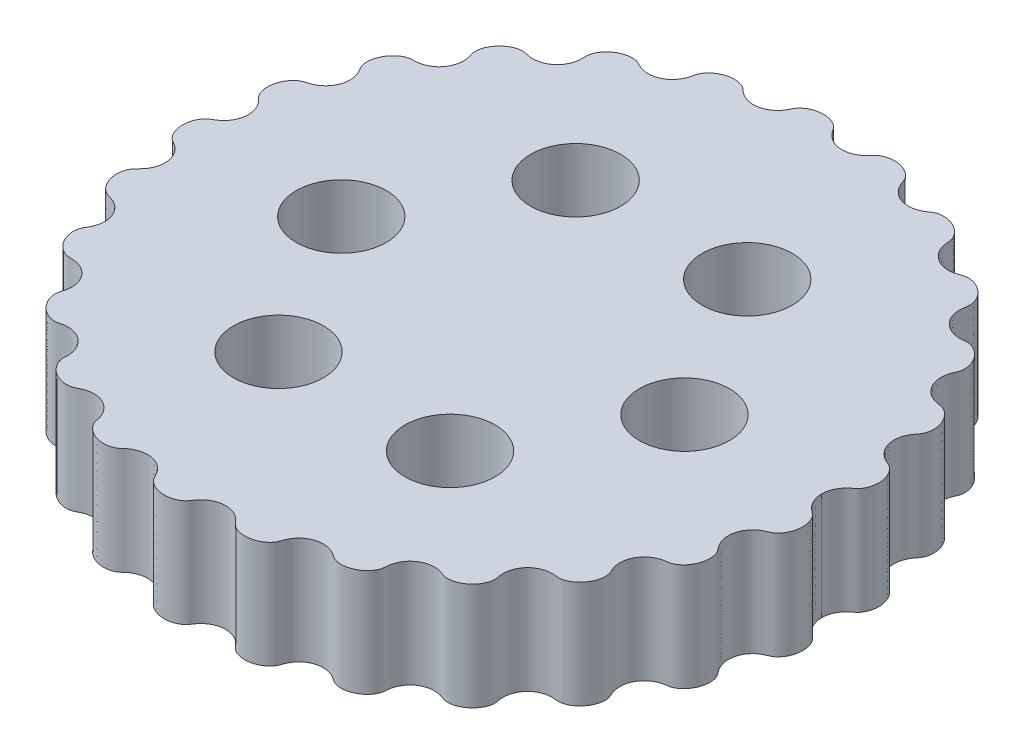
from build123d import *

# Parameters (mm, degrees)
BOSS_EXTRUDE1_DEPTH = 5
SKETCH6_R           = 2.1
CUT_EXTRUDE1_DEPTH  = 23.326267879


with BuildPart() as part:
    # Sketch4 → Boss-Extrude1 (new body)
    with BuildSketch(Plane(origin=(0, 0, 0), x_dir=(1, 0, 0), z_dir=(0, 1, 0))):
        with BuildLine():
            add(Edge.make_bspline(
                [(14.4, -1.7e-08), (14.400000001, -0.0179639), (14.400999326, -0.054155777), (14.405496287, -0.123245559), (14.417452602, -0.205733746), (14.435300791, -0.284760882), (14.458936204, -0.363829837), (14.495530725, -0.460103313), (14.553831759, -0.577672696), (14.628963289, -0.69047521), (14.720523738, -0.795156227), (14.809877944, -0.878529693), (14.885972405, -0.939710303), (14.965266318, -0.996877198), (15.039390344, -1.060755701), (15.1018131, -1.136526898), (15.154322653, -1.219306582), (15.208602449, -1.329232807), (15.256294529, -1.468797205), (15.288097075, -1.638083714), (15.294503435, -1.881017908), (15.252298066, -2.119867927), (15.1637602, -2.344380176), (15.042398564, -2.523140053), (14.94245441, -2.628650556), (14.845312037, -2.703603754), (14.757199484, -2.75037115), (14.664408662, -2.78673234), (14.573413237, -2.82696583), (14.463622, -2.885730196), (14.308968626, -2.990239544), (14.130503947, -3.16584475), (13.972147755, -3.434992937), (13.893985859, -3.773342013), (13.916927854, -4.080338903), (13.995171358, -4.310200435), (14.082412523, -4.468542002), (14.150259665, -4.567703689), (14.210026022, -4.642870296), (14.270573861, -4.71764915), (14.320176524, -4.800200553), (14.365416999, -4.910918986), (14.399338679, -5.049561592), (14.416852444, -5.262398457), (14.384340319, -5.500937501), (14.304056267, -5.731023407), (14.177986382, -5.941781709), (14.047854596, -6.095731652), (13.910789393, -6.208565653), (13.777137, -6.284416223), (13.654566629, -6.325933754), (13.550560187, -6.341335355), (13.446683903, -6.3556153), (13.344146149, -6.378219341), (13.218559064, -6.41641266), (13.049118236, -6.490187834), (12.850381491, -6.623876998), (12.649361944, -6.848376695), (12.506075667, -7.152262029), (12.46299874, -7.451003022), (12.48997225, -7.692058438), (12.539204983, -7.862350568), (12.580286972, -7.968000481), (12.61827015, -8.050352836), (12.654435799, -8.133644595), (12.678284114, -8.221362507), (12.692938305, -8.335981059), (12.690656028, -8.476153329), (12.654303526, -8.685493417), (12.545224195, -8.951239022), (12.373057401, -9.183722777), (12.149188843, -9.366304652), (11.953264529, -9.463318251), (11.811586608, -9.506241365), (11.686731924, -9.522483898), (11.583489038, -9.516968798), (11.481158628, -9.503432871), (11.378198979, -9.496859129), (11.274929533, -9.49821253), (11.172138776, -9.508022559), (11.008490275, -9.538189761), (10.791018404, -9.615836429), (10.54376529, -9.778692316), (10.34743423, -10.024278389), (10.240209593, -10.268607463), (10.194326114, -10.484243722), (10.185348079, -10.638429773), (10.193137048, -10.770510357), (10.209146619, -10.879533579), (10.225593647, -10.966240376), (10.235972878, -11.053921942), (10.233096763, -11.14231166), (10.215769233, -11.253426311), (10.176716251, -11.384209832), (10.088557736, -11.571773142), (9.914555517, -11.80057082), (9.643929478, -12.015790507), (9.33839426, -12.131431699), (9.092328835, -12.151919768), (8.938831877, -12.124722566), (8.874148355, -12.104917771), (8.823297244, -12.086266884), (8.760022234, -12.062210605), (8.657742963, -12.026792772), (8.512709046, -11.991319856), (8.295428716, -11.97104487), (8.023342576, -12.005783733), (7.739745939, -12.120021547), (7.477486579, -12.330308867), (7.309271702, -12.575786337), (7.227746068, -12.796402082), (7.194848084, -12.964652493), (7.183073794, -13.072923178), (7.177410554, -13.159952383), (7.163856527, -13.268191929), (7.120744622, -13.396146755), (7.043212114, -13.535732471), (6.896275926, -13.715388959), (6.667818283, -13.89629663), (6.347779416, -14.03871354), (6.019985541, -14.072734254), (5.761855576, -14.02689028), (5.598538488, -13.943823846), (5.51263691, -13.880075594), (5.401773626, -13.805681561), (5.259872152, -13.730304744), (5.052431839, -13.656485887), (4.77382746, -13.622953802), (4.462559435, -13.668320901), (4.188839384, -13.799904766), (3.991155398, -13.966548556), (3.857834317, -14.133926182), (3.782595695, -14.263163579), (3.730895704, -14.379947275), (3.69592382, -14.480038293), (3.66890374, -14.560561388), (3.625076907, -14.657311225), (3.549396441, -14.764707573), (3.439983046, -14.875187043), (3.255658106, -15.006023513), (2.992827177, -15.120144537), (2.651469442, -15.175704124), (2.340641018, -15.129056772), (2.125825197, -15.033765751), (2.01095266, -14.946775313), (1.969759934, -14.909017976), (1.93173959, -14.868053237), (1.895416474, -14.825543703), (1.849863622, -14.772584759), (1.773476377, -14.691024569), (1.657607797, -14.589330316), (1.467716761, -14.468702888), (1.201270806, -14.374830177), (0.894276628, -14.351781894), (0.570473221, -14.423577347), (0.317305974, -14.563244823), (0.151544702, -14.714094802), (0.048135706, -14.841769091), (-0.011407021, -14.928873544), (-0.056990631, -15.000050076), (-0.120513002, -15.08451769), (-0.216680124, -15.17111797), (-0.345491256, -15.252082884), (-0.548377405, -15.335585005), (-0.81276796, -15.385413202), (-1.083980155, -15.372591783), (-1.344979223, -15.297229029), (-1.543453081, -15.192188779), (-1.665764344, -15.097632071), (-1.75466994, -15.002005407), (-1.811224121, -14.912766255), (-1.848284502, -14.836853618), (-1.894839675, -14.742231122), (-1.981132458, -14.596441466), (-2.13046103, -14.415292593), (-2.371747135, -14.237403751), (-2.694146148, -14.1243046), (-3.005807294, -14.112083152), (-3.279802301, -14.174238455), (-3.481365526, -14.271329208), (-3.607737697, -14.358113139), (-3.692850209, -14.429558471), (-3.744273365, -14.476277951), (-3.785483991, -14.51360362), (-3.839036679, -14.557816921), (-3.971847461, -14.642561857), (-4.209211572, -14.716336999), (-4.537869609, -14.723206654), (-4.870972645, -14.623310507), (-5.119164114, -14.47411432), (-5.2872023, -14.316128509), (-5.381818777, -14.188750023), (-5.441586215, -14.068625499), (-5.469753991, -13.963937415), (-5.486204747, -13.878819236), (-5.51061517, -13.773376806), (-5.562785462, -13.611202495), (-5.668639681, -13.402851328), (-5.861501297, -13.180791236), (-6.140857489, -13.003605973), (-6.43238862, -12.920479784), (-6.707046662, -12.913936155), (-6.924586995, -12.957969238), (-7.070502232, -13.011927214), (-7.171892303, -13.061227573), (-7.234172135, -13.094294611), (-7.284237914, -13.120336964), (-7.348454125, -13.149383316), (-7.450392524, -13.181306111), (-7.592859739, -13.199325385), (-7.822504011, -13.187514265), (-8.108178823, -13.101882567), (-8.36069964, -12.948082275), (-8.564054209, -12.739258126), (-8.686860003, -12.541026141), (-8.745858699, -12.391334276), (-8.77113907, -12.257945677), (-8.769723267, -12.148159078), (-8.764488503, -12.06060027), (-8.763283534, -11.951025483), (-8.773134178, -11.82121258), (-8.801859137, -11.673190068), (-8.872937365, -11.471740845), (-9.004528254, -11.249999199), (-9.22049795, -11.035107196), (-9.499737738, -10.890462442), (-9.747533452, -10.836885462), (-9.938295916, -10.832213667), (-10.067515035, -10.843724725), (-10.169837278, -10.860858085), (-10.270401153, -10.885916097), (-10.371724701, -10.908895919), (-10.499540628, -10.914403623), (-10.649899213, -10.893032579), (-10.864421843, -10.823595982), (-11.115446738, -10.670180022), (-11.318488106, -10.46080572), (-11.461426457, -10.211875885), (-11.524752714, -10.013392151), (-11.546391671, -9.877678194), (-11.548709835, -9.764594358), (-11.539339854, -9.676135336), (-11.516898322, -9.590207442), (-11.489593068, -9.50576497), (-11.460576376, -9.39879153), (-11.437115881, -9.267755501), (-11.428038444, -9.112624579), (-11.448899273, -8.891732892), (-11.525306355, -8.644379442), (-11.680559797, -8.391694815), (-11.908334962, -8.189293006), (-12.146089512, -8.066432294), (-12.351540723, -8.011178916), (-12.509041108, -7.991840175), (-12.640826513, -7.989461218), (-12.746563832, -7.988166909), (-12.874375573, -7.9638286), (-13.017764329, -7.905880475), (-13.169248965, -7.811412503), (-13.319017823, -7.674675151), (-13.471981481, -7.480515416), (-13.581458638, -7.260884164), (-13.644013249, -7.026575852), (-13.652860905, -6.812940483), (-13.636539192, -6.672850871), (-13.606445536, -6.560514782), (-13.570431174, -6.476446714), (-13.523165972, -6.398238245), (-13.475169426, -6.320638538), (-13.421523052, -6.219949406), (-13.352206464, -6.055610198), (-13.29722316, -5.81780624), (-13.306143965, -5.511232379), (-13.418270819, -5.185793038), (-13.599550695, -4.93728619), (-13.788421679, -4.782571213), (-13.950444323, -4.693123203), (-14.068010578, -4.644082106), (-14.164678216, -4.612082102), (-14.263358735, -4.586969006), (-14.360622611, -4.556204334), (-14.472064505, -4.49721395), (-14.590574792, -4.405388416), (-14.741515619, -4.240877376), (-14.885567708, -3.98404055), (-14.960547252, -3.700014104), (-14.96247696, -3.409357531), (-14.917122555, -3.199365653), (-14.864866144, -3.065551057), (-14.804762426, -2.961268499), (-14.743749543, -2.885986355), (-14.673498554, -2.819366755), (-14.604759909, -2.751454728), (-14.541077435, -2.678635812), (-14.482882307, -2.601337069), (-14.398435021, -2.468449218), (-14.309915882, -2.267782245), (-14.257239539, -1.991630736), (-14.294765434, -1.652711694), (-14.415656613, -1.372497705), (-14.564768472, -1.180603046), (-14.70094567, -1.058517905), (-14.801501647, -0.985661639), (-14.885953427, -0.933566402), (-14.97324048, -0.886147395), (-15.055953147, -0.830915972), (-15.145345976, -0.745703154), (-15.234104555, -0.627877241), (-15.302099626, -0.497917519), (-15.35057086, -0.359470052), (-15.378415702, -0.242181118), (-15.393222627, -0.147288714), (-15.398767773, -0.063519467), (-15.399999999, -0.021213905), (-15.4, -1.594e-06)],
                knots=[0.062565796, 0.062565796, 0.062565796, 0.062565796, 0.062565796, 0.063859973, 0.06515415, 0.066448326, 0.067742503, 0.06903668, 0.070330857, 0.07291921, 0.075992333, 0.077528894, 0.079065456, 0.080602017, 0.082138578, 0.08367514, 0.085211701, 0.086753761, 0.088295822, 0.091379943, 0.094464064, 0.097548185, 0.103528845, 0.106519174, 0.109509504, 0.111075374, 0.112641243, 0.114207112, 0.115772981, 0.117338851, 0.11890472, 0.122036458, 0.127492162, 0.132947866, 0.138255082, 0.143562297, 0.146585003, 0.148096356, 0.149607709, 0.151119061, 0.152630414, 0.154141767, 0.15565312, 0.158617995, 0.161582869, 0.167512619, 0.170668106, 0.173823593, 0.17697908, 0.180134567, 0.181785014, 0.183435461, 0.185085908, 0.186736355, 0.188386802, 0.190037249, 0.193338142, 0.198333612, 0.203329082, 0.208757311, 0.21418554, 0.217038738, 0.218465337, 0.219891935, 0.221318534, 0.222745133, 0.224171732, 0.225598331, 0.22856804, 0.23153775, 0.237477169, 0.243508984, 0.246524892, 0.2495408, 0.251163787, 0.252786774, 0.254409762, 0.256032749, 0.257655736, 0.259278723, 0.26090171, 0.262524697, 0.268116353, 0.273708009, 0.279232337, 0.2819945, 0.284756664, 0.287531357, 0.288918704, 0.290306051, 0.291693397, 0.293080744, 0.294468091, 0.295855437, 0.298751953, 0.301648468, 0.307441499, 0.313806246, 0.320170993, 0.321874543, 0.322726318, 0.323578093, 0.324429868, 0.325281643, 0.326985192, 0.330392292, 0.333799391, 0.338941908, 0.344084424, 0.349371027, 0.354657629, 0.357399899, 0.358771034, 0.360142168, 0.361513303, 0.362884438, 0.365626708, 0.368571539, 0.37151637, 0.377406032, 0.383827609, 0.390249186, 0.391929851, 0.393610516, 0.39529118, 0.396971845, 0.400333174, 0.403694503, 0.409075747, 0.41445699, 0.419832854, 0.422520785, 0.425208717, 0.427878342, 0.429213155, 0.430547968, 0.431882781, 0.433217593, 0.435887219, 0.438758038, 0.441628857, 0.447370496, 0.453780785, 0.460191075, 0.461070296, 0.461949517, 0.462828738, 0.463707959, 0.46458718, 0.465466401, 0.467224842, 0.470741726, 0.47425861, 0.479541903, 0.484825197, 0.489835983, 0.494846769, 0.497503724, 0.498832202, 0.500160679, 0.501489157, 0.502817634, 0.505474589, 0.508247059, 0.511019529, 0.516564468, 0.52227034, 0.525123276, 0.527976212, 0.530631288, 0.531958826, 0.533286364, 0.534613902, 0.53594144, 0.538596516, 0.543936045, 0.549275574, 0.554531257, 0.559786941, 0.563284399, 0.566781857, 0.568530587, 0.569404951, 0.570279316, 0.57115368, 0.572028045, 0.573776774, 0.580152949, 0.586529123, 0.592383377, 0.595310504, 0.598237631, 0.600962992, 0.602325673, 0.603688354, 0.605051034, 0.606413715, 0.609139076, 0.614392618, 0.619646159, 0.624660447, 0.629674735, 0.633223523, 0.636772312, 0.638546707, 0.639433904, 0.640321101, 0.641208298, 0.642095495, 0.64386989, 0.647025799, 0.650181709, 0.656493529, 0.662419511, 0.665382503, 0.668345494, 0.671104535, 0.672484055, 0.673863575, 0.675243096, 0.676622616, 0.679381657, 0.682041398, 0.68470114, 0.690020622, 0.695473381, 0.700926139, 0.704188253, 0.70581931, 0.707450368, 0.709081425, 0.710712482, 0.712343539, 0.713974596, 0.717095441, 0.720216286, 0.726457975, 0.732286917, 0.735201388, 0.738115858, 0.739511278, 0.740906697, 0.742302116, 0.743697535, 0.745092954, 0.746488373, 0.749279211, 0.752059022, 0.754838832, 0.760398454, 0.765423781, 0.770449108, 0.773768675, 0.777088241, 0.778748025, 0.780407808, 0.782067591, 0.783727374, 0.786901153, 0.790074931, 0.793248709, 0.796422487, 0.802397424, 0.805384893, 0.808372361, 0.809807963, 0.811243566, 0.812679168, 0.81411477, 0.815550372, 0.816985974, 0.819857178, 0.825317904, 0.830778629, 0.835989797, 0.841200965, 0.844404173, 0.846005778, 0.847607382, 0.849208986, 0.85081059, 0.852412194, 0.854013798, 0.857107086, 0.860200373, 0.866386948, 0.872352981, 0.875335998, 0.878319014, 0.879839881, 0.881360748, 0.882881615, 0.884402482, 0.885923349, 0.887444216, 0.888965083, 0.890485949, 0.895823145, 0.90116034, 0.906397405, 0.911634469, 0.914757263, 0.91631866, 0.917880057, 0.919441454, 0.921002851, 0.922564248, 0.924125645, 0.927182053, 0.930238461, 0.931766665, 0.933294869, 0.934823073, 0.936351308, 0.936351308, 0.936351308, 0.936351308, 0.936351308], degree=4))
            add(Edge.make_bspline(
                [(14.4, -1.7e-08), (14.4, 0.017963997), (14.400999323, 0.054155874), (14.405496281, 0.123245656), (14.417452591, 0.205733845), (14.435300775, 0.284760982), (14.458936185, 0.363829937), (14.4955307, 0.460103415), (14.553831728, 0.577672801), (14.628963253, 0.69047532), (14.720523696, 0.795156341), (14.809877897, 0.878529812), (14.885972355, 0.939710427), (14.965266265, 0.996877326), (15.039390288, 1.060755833), (15.10181304, 1.136527033), (15.154322588, 1.21930672), (15.208602379, 1.329232947), (15.256294452, 1.468797348), (15.288096989, 1.638083858), (15.294503336, 1.881018053), (15.252297954, 2.11986807), (15.163760076, 2.344380314), (15.042398431, 2.523140184), (14.942454271, 2.628650683), (14.845311894, 2.703603875), (14.757199339, 2.750371267), (14.664408514, 2.786732452), (14.573413087, 2.826965937), (14.463621848, 2.885730297), (14.308968467, 2.990239637), (14.130503779, 3.165844833), (13.972147573, 3.434993012), (13.893985659, 3.773342084), (13.916927638, 4.080338975), (13.99517113, 4.310200511), (14.082412286, 4.468542083), (14.150259423, 4.567703774), (14.210025776, 4.642870383), (14.270573611, 4.717649241), (14.32017627, 4.800200647), (14.365416739, 4.910919082), (14.399338411, 5.049561689), (14.416852165, 5.262398556), (14.384340028, 5.500937598), (14.304055963, 5.7310235), (14.177986067, 5.941781795), (14.047854273, 6.095731731), (13.910789064, 6.208565725), (13.777136668, 6.284416288), (13.654566295, 6.325933813), (13.550559851, 6.341335407), (13.446683566, 6.355615347), (13.344145812, 6.378219382), (13.218558725, 6.416412695), (13.049117892, 6.49018786), (12.850381141, 6.623877014), (12.649361581, 6.8483767), (12.506075288, 7.152262026), (12.462998345, 7.451003017), (12.489971843, 7.692058434), (12.539204567, 7.862350567), (12.58028655, 7.968000482), (12.618269724, 8.050352839), (12.654435369, 8.1336446), (12.678283679, 8.221362513), (12.692937864, 8.335981067), (12.690655579, 8.476153336), (12.654303066, 8.685493422), (12.545223721, 8.951239022), (12.373056915, 9.183722767), (12.149188347, 9.36630463), (11.953264028, 9.463318219), (11.811586105, 9.506241326), (11.68673142, 9.522483852), (11.583488535, 9.516968746), (11.481158125, 9.503432814), (11.378198476, 9.496859067), (11.27492903, 9.498212462), (11.172138272, 9.508022486), (11.00848977, 9.538189679), (10.791017895, 9.615836336), (10.543764772, 9.778692209), (10.347433699, 10.024278272), (10.24020905, 10.26860734), (10.194325559, 10.484243597), (10.185347516, 10.638429648), (10.193136478, 10.770510232), (10.209146043, 10.879533455), (10.225593066, 10.966240253), (10.235972292, 11.053921819), (10.233096174, 11.142311537), (10.215768637, 11.253426187), (10.176715648, 11.384209706), (10.088557124, 11.571773012), (9.914554892, 11.80057068), (9.643928842, 12.015790353), (9.338393618, 12.131431528), (9.092328191, 12.151919585), (8.938831235, 12.124722374), (8.874147714, 12.104917576), (8.823296604, 12.086266686), (8.760021595, 12.062210404), (8.657742326, 12.026792566), (8.512708411, 11.991319642), (8.295428082, 11.971044645), (8.02334194, 12.005783493), (7.739745297, 12.120021292), (7.477485926, 12.330308598), (7.309271036, 12.575786059), (7.227745391, 12.7964018), (7.194847398, 12.964652209), (7.183073102, 13.072922894), (7.177409857, 13.159952099), (7.163855825, 13.268191644), (7.120743913, 13.396146467), (7.043211398, 13.535732179), (6.8962752, 13.71538866), (6.667817547, 13.896296318), (6.347778672, 14.038713212), (6.019984796, 14.072733908), (5.761854834, 14.02688992), (5.59853775, 13.943823477), (5.512636175, 13.880075221), (5.401772895, 13.805681182), (5.259871426, 13.730304358), (5.052431116, 13.65648549), (4.773826739, 13.62295339), (4.462558712, 13.668320473), (4.188838653, 13.799904324), (3.991154659, 13.966548102), (3.857833569, 14.133925722), (3.78259494, 14.263163115), (3.730894943, 14.379946808), (3.695923054, 14.480037824), (3.66890297, 14.560560918), (3.625076131, 14.657310752), (3.549395659, 14.764707096), (3.439982259, 14.87518656), (3.255657311, 15.006023021), (2.992826376, 15.12014403), (2.651468639, 15.1757036), (2.340640217, 15.129056231), (2.125824401, 15.033765199), (2.010951868, 14.946774755), (1.969759145, 14.909017416), (1.931738803, 14.868052675), (1.895415689, 14.825543138), (1.84986284, 14.772584192), (1.773475599, 14.691023999), (1.657607025, 14.589329739), (1.467715995, 14.468702301), (1.201270045, 14.374829576), (0.894275868, 14.351781276), (0.570472458, 14.423576713), (0.317305203, 14.563244175), (0.151543923, 14.714094145), (0.04813492, 14.841768429), (-0.011407811, 14.928872879), (-0.056991425, 15.000049408), (-0.120513801, 15.084517019), (-0.216680927, 15.171117293), (-0.345492063, 15.252082201), (-0.548378217, 15.335584311), (-0.812768774, 15.385412494), (-1.083980969, 15.372591061), (-1.344980032, 15.297228294), (-1.543453885, 15.192188032), (-1.665765143, 15.097631318), (-1.754670735, 15.00200465), (-1.81122491, 14.912765494), (-1.848285287, 14.836852855), (-1.894840456, 14.742230357), (-1.98113323, 14.596440697), (-2.130461793, 14.415291815), (-2.371747889, 14.23740296), (-2.694146896, 14.124303792), (-3.005808041, 14.112082329), (-3.279803051, 14.174237617), (-3.481366281, 14.271328359), (-3.607738457, 14.358112283), (-3.692850973, 14.42955761), (-3.744274132, 14.476277088), (-3.785484759, 14.513602755), (-3.83903745, 14.557816053), (-3.971848236, 14.642560982), (-4.209212351, 14.716336112), (-4.537870388, 14.723205749), (-4.870973419, 14.623309584), (-5.11916488, 14.474113384), (-5.287203058, 14.316127565), (-5.381819528, 14.188749074), (-5.44158696, 14.068624547), (-5.46975473, 13.96393646), (-5.486205481, 13.878818281), (-5.510615899, 13.77337585), (-5.562786182, 13.611201536), (-5.66864039, 13.402850363), (-5.861501995, 13.180790261), (-6.140858177, 13.003604984), (-6.432389304, 12.920478779), (-6.707047346, 12.913935136), (-6.924587681, 12.957968207), (-7.070502921, 13.011926175), (-7.171892995, 13.061226529), (-7.234172828, 13.094293563), (-7.284238608, 13.120335914), (-7.348454821, 13.149382263), (-7.450393222, 13.181305052), (-7.592860438, 13.199324318), (-7.822504709, 13.187513187), (-8.108179517, 13.101881473), (-8.360700325, 12.948081167), (-8.564054883, 12.739257008), (-8.686860667, 12.541025017), (-8.745859355, 12.391333149), (-8.771139719, 12.257944548), (-8.76972391, 12.148157949), (-8.764489142, 12.060599142), (-8.763284167, 11.951024354), (-8.773134803, 11.821211451), (-8.801859755, 11.673188937), (-8.872937972, 11.471739711), (-9.004528849, 11.249998058), (-9.220498534, 11.035106043), (-9.499738314, 10.890461274), (-9.747534026, 10.836884282), (-9.93829649, 10.832212477), (-10.067515609, 10.843723528), (-10.169837853, 10.860856882), (-10.27040173, 10.885914889), (-10.371725278, 10.908894705), (-10.499541206, 10.914402403), (-10.649899789, 10.893031351), (-10.864422416, 10.823594743), (-11.115447303, 10.670178769), (-11.31848866, 10.460804456), (-11.461426998, 10.211874613), (-11.524753245, 10.013390876), (-11.546392194, 9.877676918), (-11.548710352, 9.764593082), (-11.539340366, 9.676134061), (-11.516898829, 9.590206168), (-11.489593571, 9.505763697), (-11.460576873, 9.398790259), (-11.437116372, 9.267754231), (-11.428038926, 9.112623309), (-11.448899743, 8.891731622), (-11.525306813, 8.644378167), (-11.680560241, 8.391693532), (-11.908335396, 8.189291711), (-12.146089939, 8.066430986), (-12.351541147, 8.011177597), (-12.509041531, 7.991838848), (-12.640826936, 7.989459884), (-12.746564255, 7.98816557), (-12.874375995, 7.963827254), (-13.017764748, 7.905879122), (-13.169249379, 7.811411141), (-13.319018229, 7.674673781), (-13.471981877, 7.480514038), (-13.581459023, 7.26088278), (-13.644013621, 7.026574465), (-13.652861266, 6.812939095), (-13.636539546, 6.672849485), (-13.606445884, 6.560513397), (-13.570431517, 6.476445331), (-13.523166311, 6.398236864), (-13.47516976, 6.32063716), (-13.421523381, 6.219948031), (-13.352206784, 6.055608826), (-13.297223468, 5.817804871), (-13.306144256, 5.51123101), (-13.418271093, 5.185791663), (-13.599550957, 4.937284805), (-13.788421932, 4.782569819), (-13.950444572, 4.6931218), (-14.068010823, 4.644080697), (-14.16467846, 4.612080687), (-14.263358978, 4.586967586), (-14.360622852, 4.556202909), (-14.472064743, 4.497212519), (-14.590575025, 4.405386979), (-14.741515844, 4.240875931), (-14.885567919, 3.984039098), (-14.960547448, 3.700012648), (-14.96247714, 3.409356074), (-14.917122724, 3.199364199), (-14.864866306, 3.065549606), (-14.804762583, 2.96126705), (-14.743749696, 2.88598491), (-14.673498703, 2.819365313), (-14.604760055, 2.75145329), (-14.541077577, 2.678634378), (-14.482882445, 2.601335638), (-14.398435152, 2.468447791), (-14.309916002, 2.267780823), (-14.257239645, 1.991629317), (-14.294765521, 1.652710273), (-14.415656685, 1.372496277), (-14.564768534, 1.180601611), (-14.700945726, 1.058516462), (-14.801501699, 0.985660191), (-14.885953477, 0.933564949), (-14.973240527, 0.886145938), (-15.055953191, 0.83091451), (-15.145346016, 0.745701687), (-15.234104589, 0.62787577), (-15.302099652, 0.497916044), (-15.350570879, 0.359468574), (-15.378415715, 0.242179639), (-15.393222635, 0.147287235), (-15.398767777, 0.063517987), (-15.4, 0.021212425), (-15.4, -1.594e-06)],
                knots=[0.062565796, 0.062565796, 0.062565796, 0.062565796, 0.062565796, 0.063859973, 0.06515415, 0.066448326, 0.067742503, 0.06903668, 0.070330857, 0.07291921, 0.075992333, 0.077528894, 0.079065456, 0.080602017, 0.082138578, 0.08367514, 0.085211701, 0.086753761, 0.088295822, 0.091379943, 0.094464064, 0.097548185, 0.103528845, 0.106519174, 0.109509504, 0.111075374, 0.112641243, 0.114207112, 0.115772981, 0.117338851, 0.11890472, 0.122036458, 0.127492162, 0.132947866, 0.138255082, 0.143562297, 0.146585003, 0.148096356, 0.149607709, 0.151119061, 0.152630414, 0.154141767, 0.15565312, 0.158617995, 0.161582869, 0.167512619, 0.170668106, 0.173823593, 0.17697908, 0.180134567, 0.181785014, 0.183435461, 0.185085908, 0.186736355, 0.188386802, 0.190037249, 0.193338142, 0.198333612, 0.203329082, 0.208757311, 0.21418554, 0.217038738, 0.218465337, 0.219891935, 0.221318534, 0.222745133, 0.224171732, 0.225598331, 0.22856804, 0.23153775, 0.237477169, 0.243508984, 0.246524892, 0.2495408, 0.251163787, 0.252786774, 0.254409762, 0.256032749, 0.257655736, 0.259278723, 0.26090171, 0.262524697, 0.268116353, 0.273708009, 0.279232337, 0.2819945, 0.284756664, 0.287531357, 0.288918704, 0.290306051, 0.291693397, 0.293080744, 0.294468091, 0.295855437, 0.298751953, 0.301648468, 0.307441499, 0.313806246, 0.320170993, 0.321874543, 0.322726318, 0.323578093, 0.324429868, 0.325281643, 0.326985192, 0.330392292, 0.333799391, 0.338941908, 0.344084424, 0.349371027, 0.354657629, 0.357399899, 0.358771034, 0.360142168, 0.361513303, 0.362884438, 0.365626708, 0.368571539, 0.37151637, 0.377406032, 0.383827609, 0.390249186, 0.391929851, 0.393610516, 0.39529118, 0.396971845, 0.400333174, 0.403694503, 0.409075747, 0.41445699, 0.419832854, 0.422520785, 0.425208717, 0.427878342, 0.429213155, 0.430547968, 0.431882781, 0.433217593, 0.435887219, 0.438758038, 0.441628857, 0.447370496, 0.453780785, 0.460191075, 0.461070296, 0.461949517, 0.462828738, 0.463707959, 0.46458718, 0.465466401, 0.467224842, 0.470741726, 0.47425861, 0.479541903, 0.484825197, 0.489835983, 0.494846769, 0.497503724, 0.498832202, 0.500160679, 0.501489157, 0.502817634, 0.505474589, 0.508247059, 0.511019529, 0.516564468, 0.52227034, 0.525123276, 0.527976212, 0.530631288, 0.531958826, 0.533286364, 0.534613902, 0.53594144, 0.538596516, 0.543936045, 0.549275574, 0.554531257, 0.559786941, 0.563284399, 0.566781857, 0.568530587, 0.569404951, 0.570279316, 0.57115368, 0.572028045, 0.573776774, 0.580152949, 0.586529123, 0.592383377, 0.595310504, 0.598237631, 0.600962992, 0.602325673, 0.603688354, 0.605051034, 0.606413715, 0.609139076, 0.614392618, 0.619646159, 0.624660447, 0.629674735, 0.633223523, 0.636772312, 0.638546707, 0.639433904, 0.640321101, 0.641208298, 0.642095495, 0.64386989, 0.647025799, 0.650181709, 0.656493529, 0.662419511, 0.665382503, 0.668345494, 0.671104535, 0.672484055, 0.673863575, 0.675243096, 0.676622616, 0.679381657, 0.682041398, 0.68470114, 0.690020622, 0.695473381, 0.700926139, 0.704188253, 0.70581931, 0.707450368, 0.709081425, 0.710712482, 0.712343539, 0.713974596, 0.717095441, 0.720216286, 0.726457975, 0.732286917, 0.735201388, 0.738115858, 0.739511278, 0.740906697, 0.742302116, 0.743697535, 0.745092954, 0.746488373, 0.749279211, 0.752059022, 0.754838832, 0.760398454, 0.765423781, 0.770449108, 0.773768675, 0.777088241, 0.778748025, 0.780407808, 0.782067591, 0.783727374, 0.786901153, 0.790074931, 0.793248709, 0.796422487, 0.802397424, 0.805384893, 0.808372361, 0.809807963, 0.811243566, 0.812679168, 0.81411477, 0.815550372, 0.816985974, 0.819857178, 0.825317904, 0.830778629, 0.835989797, 0.841200965, 0.844404173, 0.846005778, 0.847607382, 0.849208986, 0.85081059, 0.852412194, 0.854013798, 0.857107086, 0.860200373, 0.866386948, 0.872352981, 0.875335998, 0.878319014, 0.879839881, 0.881360748, 0.882881615, 0.884402482, 0.885923349, 0.887444216, 0.888965083, 0.890485949, 0.895823145, 0.90116034, 0.906397405, 0.911634469, 0.914757263, 0.91631866, 0.917880057, 0.919441454, 0.921002851, 0.922564248, 0.924125645, 0.927182053, 0.930238461, 0.931766665, 0.933294869, 0.934823073, 0.936351277, 0.936351277, 0.936351277, 0.936351277, 0.936351277], degree=4))
        make_face()
    extrude(amount=BOSS_EXTRUDE1_DEPTH)

    # Sketch6 → Cut-Extrude1 (cut, through all)
    with BuildSketch(Plane(origin=(0, 0, 0), x_dir=(1, 0, 0), z_dir=(0, 1, 0))):
        with Locations(Location((8, 1.13e-07, 0), (0, 0, 270))):
            Circle(SKETCH6_R)
        with Locations(Location((4, 6.928203343, 0), (0, 0, 270))):
            Circle(SKETCH6_R)
        with Locations(Location((-4, 6.928203343, 0), (0, 0, 270))):
            Circle(SKETCH6_R)
        with Locations(Location((-8, 1.13e-07, 0), (0, 0, 270))):
            Circle(SKETCH6_R)
        with Locations(Location((-4, -6.928203117, 0), (0, 0, 270))):
            Circle(SKETCH6_R)
        with Locations(Location((4, -6.928203117, 0), (0, 0, 270))):
            Circle(SKETCH6_R)
    extrude(amount=CUT_EXTRUDE1_DEPTH, mode=Mode.SUBTRACT)


solid = part.part
